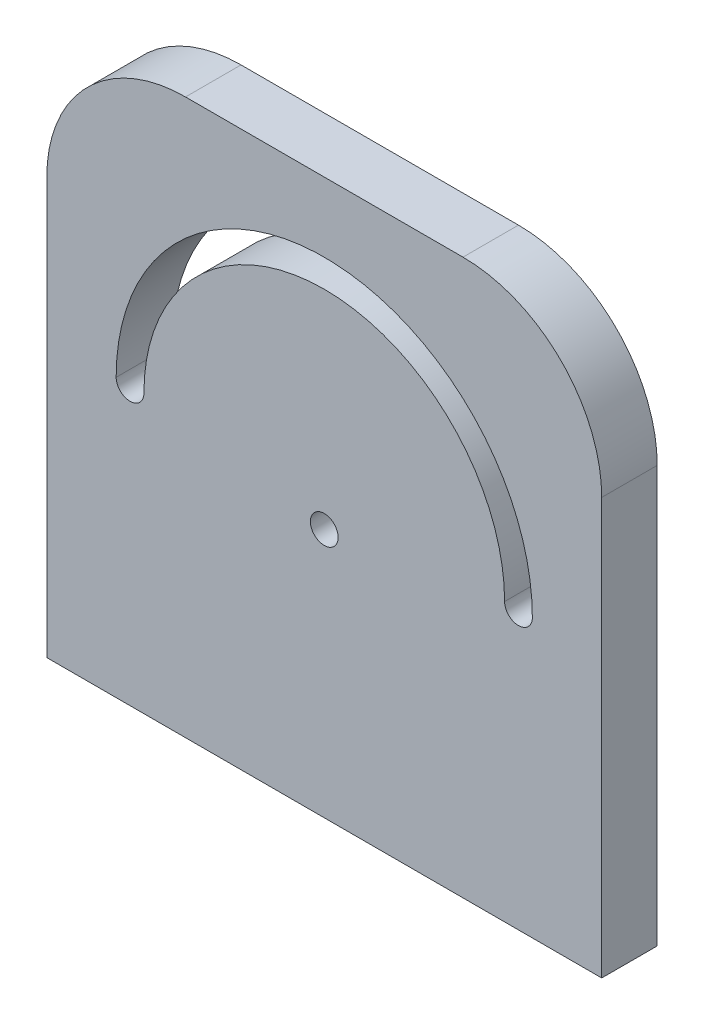
from build123d import *

# Parameters (mm, degrees)
SKETCH1_W           = 100
SKETCH1_H           = 100
BOSS_EXTRUDE1_DEPTH = 10
CUT_EXTRUDE1_REACH  = 73.414
SKETCH2_R           = 2.5
SKETCH3_R           = 2.5
CUT_EXTRUDE2_DEPTH  = 20
FILLET2_R           = 25
FILLET3_R           = 25


with BuildPart() as part:
    # Sketch1 → Boss-Extrude1 (new body)
    with BuildSketch(Plane.XY):
        Rectangle(SKETCH1_W, SKETCH1_H)
    extrude(amount=BOSS_EXTRUDE1_DEPTH)

    # Sketch2 → Cut-Extrude1 (cut, up to next)
    with BuildSketch(Plane(origin=(0, 0, 0), x_dir=(-1, 0, 0), z_dir=(0, 0, -1)), mode=Mode.PRIVATE) as cut_extrude1_sk1:
        with Locations((0, -5)):
            Circle(SKETCH2_R)
    cut_extrude1_tool1 = extrude(cut_extrude1_sk1.sketch, amount=-CUT_EXTRUDE1_REACH, mode=Mode.PRIVATE) & part.part
    # Sketch2 → Cut-Extrude1 (cut, up to next)
    with BuildSketch(Plane(origin=(0, 0, 0), x_dir=(-1, 0, 0), z_dir=(0, 0, -1)), mode=Mode.PRIVATE) as cut_extrude1_sk2:
        with BuildLine():
            ThreePointArc((37.5, 0), (0, 37.5), (-37.5, 0))
            ThreePointArc((-37.5, 0), (-35, -2.5), (-32.5, 0))
            ThreePointArc((-32.5, 0), (0, 32.5), (32.5, 0))
            ThreePointArc((32.5, 0), (35, -2.5), (37.5, 0))
        make_face()
    cut_extrude1_tool2 = extrude(cut_extrude1_sk2.sketch, amount=-CUT_EXTRUDE1_REACH, mode=Mode.PRIVATE) & part.part
    add(cut_extrude1_tool1.solids().sort_by_distance((0, -5, 0))[0], mode=Mode.SUBTRACT)
    add(cut_extrude1_tool2.solids().sort_by_distance((0, 33.35, 0))[0], mode=Mode.SUBTRACT)

    # Sketch3 → Cut-Extrude2 (cut)
    with BuildSketch(Plane.XZ.offset(50)):
        with Locations((-35, 5)):
            Circle(SKETCH3_R)
        with Locations((0, 5)):
            Circle(SKETCH3_R)
        with Locations((35, 5)):
            Circle(SKETCH3_R)
    extrude(amount=-CUT_EXTRUDE2_DEPTH, mode=Mode.SUBTRACT)

    # Fillet2
    fillet2_edges = [part.edges().sort_by_distance(p)[0] for p in [
        (-50, 50, 5),
    ]]
    fillet(fillet2_edges, radius=FILLET2_R)

    # Fillet3
    fillet3_edges = [part.edges().sort_by_distance(p)[0] for p in [
        (50, 50, 5),
    ]]
    fillet(fillet3_edges, radius=FILLET3_R)


solid = part.part
